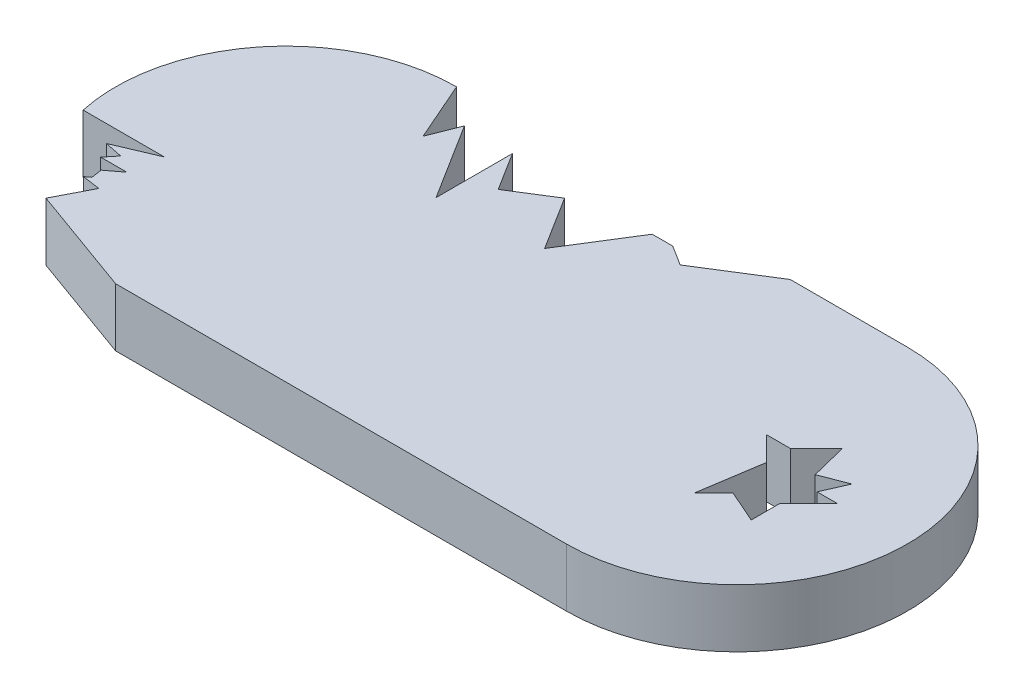
from build123d import *

# Parameters (mm, degrees)
BOSS_EXTRUDE1_DEPTH = 12.7


with BuildPart() as part:
    # Sketch1 → Boss-Extrude1 (new body)
    with BuildSketch(Plane(origin=(0, 0, 0), x_dir=(1, 0, 0), z_dir=(0, 1, 0))):
        with BuildLine():
            Line((53.277347388, 37.21280371), (27.692764767, 37.21280371))
            Line((27.692764767, 37.21280371), (12.941319101, 27.952087025))
            Line((12.941319101, 27.952087025), (8.540643474, 30.705646777))
            Line((8.540643474, 30.705646777), (4.066973083, 30.705646777))
            Line((4.066973083, 30.705646777), (-4.969353988, 16.263997468))
            Line((-4.969353988, 16.263997468), (-12.306945735, 27.952087025))
            Line((-12.306945735, 27.952087025), (-21.201307507, 22.368351957))
            Line((-21.201307507, 22.368351957), (-26.43532504, 30.705646777))
            Line((-26.43532504, 30.705646777), (-26.43532504, 14.031057137))
            Line((-26.43532504, 14.031057137), (-36.903360106, 30.705646777))
            Line((-36.903360106, 30.705646777), (-39.449638906, 24.198489844))
            Line((-39.449638906, 24.198489844), (-45.143401222, 37.21280371))
            ThreePointArc((-45.143401222, 37.21280371), (-74.127657469, 23.338929919), (-81.499787082, -7.937629821))
            Line((-81.499787082, -7.937629821), (-63.784157153, -7.937629821))
            Line((-63.784157153, -7.937629821), (-72.641972118, -11.70947558))
            Line((-72.641972118, -11.70947558), (-68.727071589, -12.511169013))
            Line((-68.727071589, -12.511169013), (-70.684521854, -14.91719786))
            Line((-70.684521854, -14.91719786), (-64.97814292, -14.91719786))
            Line((-64.97814292, -14.91719786), (-68.180229032, -17.32540427))
            Line((-68.180229032, -17.32540427), (-67.831332387, -19.673301397))
            Line((-67.831332387, -19.673301397), (-68.906488172, -20.481898343))
            Line((-68.906488172, -20.481898343), (-64.97814292, -21.037775518))
            Line((-64.97814292, -21.037775518), (-68.906488172, -28.637535833))
            Line((-68.906488172, -28.637535833), (-45.143401222, -37.21280371))
            Line((-45.143401222, -37.21280371), (53.277347388, -37.21280371))
            ThreePointArc((53.277347388, -37.21280371), (90.490151098, 0), (53.277347388, 37.21280371))
        make_face()
        Polygon((65.339708642, 10.937039543), (67.312961335, 3.038472361), (73.091855891, 5.285820244), (70.766094983, 0), (75.147452652, 0), (68.896846804, -6.250605848), (68.896846804, -12.511169013), (61.782570481, -9.38088743), (57.594408206, -13.569049705), (59.688489343, 0), (54.402669099, 5.285820244), (59.688489343, 5.285820244), align=None, mode=Mode.SUBTRACT)
    extrude(amount=BOSS_EXTRUDE1_DEPTH)


solid = part.part
